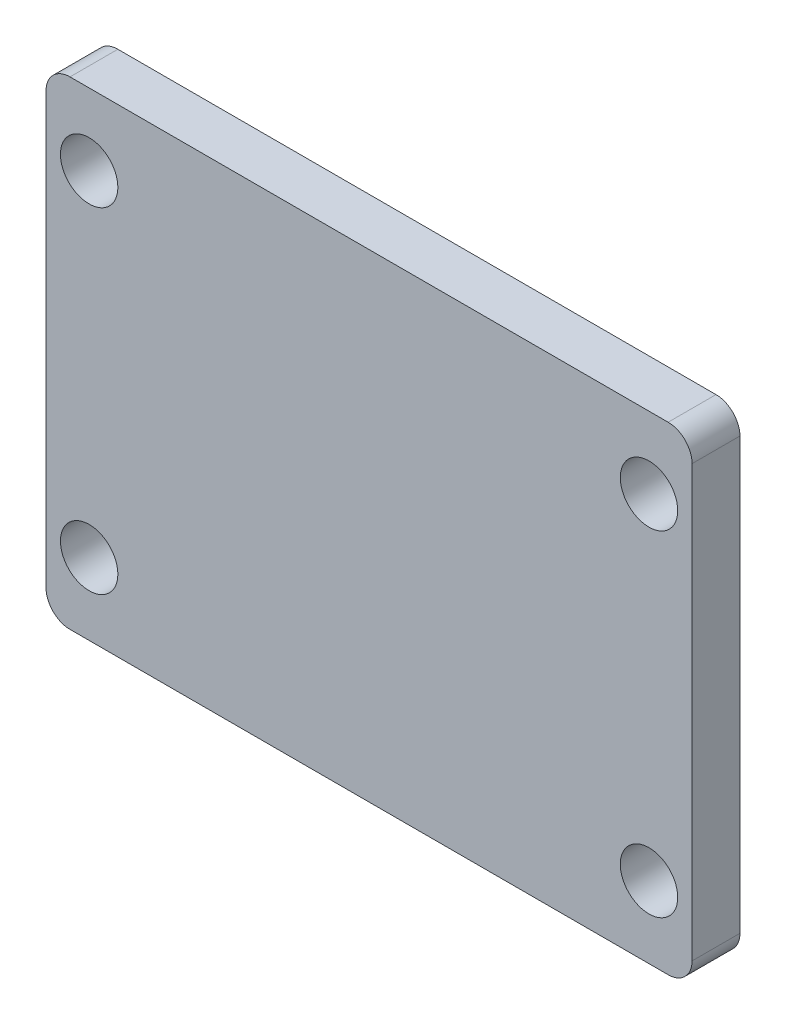
from build123d import *

# Parameters (mm, degrees)
SKETCH2_R           = 6
BOSS_EXTRUDE1_DEPTH = 10


with BuildPart() as part:
    # Sketch2 → Boss-Extrude1 (new body)
    with BuildSketch(Plane(origin=(0, 0, 0), x_dir=(0, 1, 0), z_dir=(0, 0, 1))):
        with BuildLine():
            Line((-45, -67.5), (45, -67.5))
            ThreePointArc((45, -67.5), (48.535533906, -66.035533906), (50, -62.5))
            Line((50, -62.5), (50, 62.5))
            ThreePointArc((50, 62.5), (48.535533906, 66.035533906), (45, 67.5))
            Line((45, 67.5), (-45, 67.5))
            ThreePointArc((-45, 67.5), (-48.535533906, 66.035533906), (-50, 62.5))
            Line((-50, 62.5), (-50, -62.5))
            ThreePointArc((-50, -62.5), (-48.535533906, -66.035533906), (-45, -67.5))
        make_face()
        with Locations(Location((-35, 58.5, 0), (0, 0, 270))):
            Circle(SKETCH2_R, mode=Mode.SUBTRACT)
        with Locations(Location((35, 58.5, 0), (0, 0, 270))):
            Circle(SKETCH2_R, mode=Mode.SUBTRACT)
        with Locations(Location((35, -58.5, 0), (0, 0, 270))):
            Circle(SKETCH2_R, mode=Mode.SUBTRACT)
        with Locations(Location((-35, -58.5, 0), (0, 0, 270))):
            Circle(SKETCH2_R, mode=Mode.SUBTRACT)
    extrude(amount=BOSS_EXTRUDE1_DEPTH)


solid = part.part
